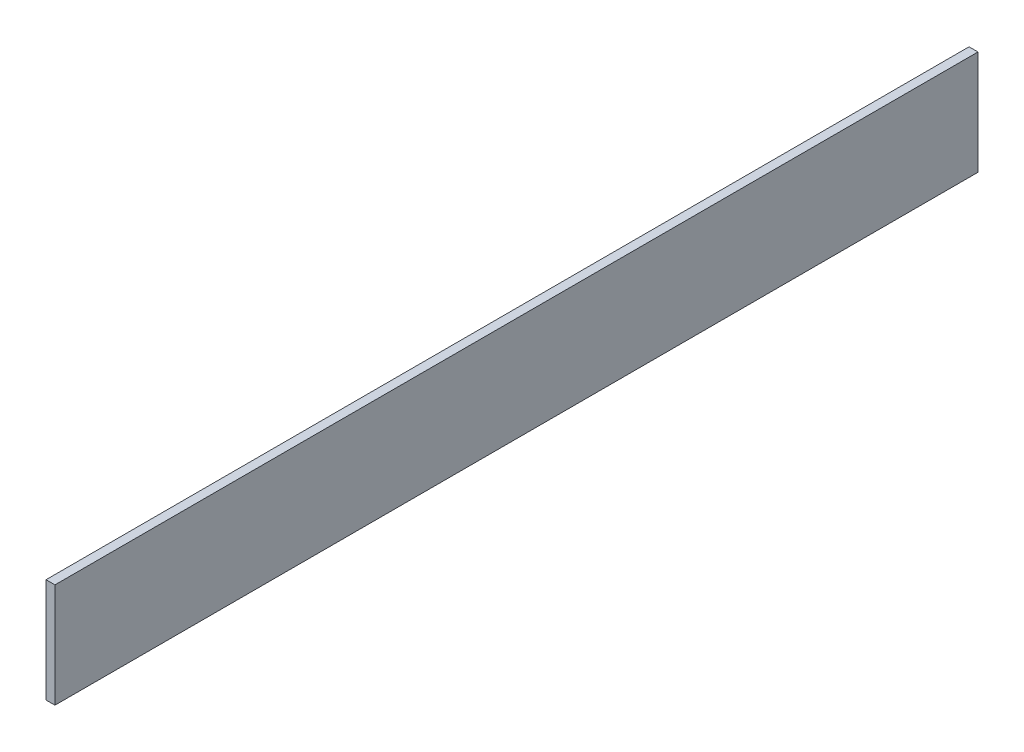
from build123d import *

# Parameters (mm, degrees)
IZIM1_W                     = 310
IZIM1_H                     = 35
Y_KSEKLIK_EKSTR_ZYON1_DEPTH = 3


with BuildPart() as part:
    # Çizim1 → Yükseklik-Ekstrüzyon1 (new body)
    with BuildSketch(Plane(origin=(0, 0, 0), x_dir=(0, 0, -1), z_dir=(1, 0, 0))):
        with Locations((155, 17.5)):
            Rectangle(IZIM1_W, IZIM1_H)
    extrude(amount=Y_KSEKLIK_EKSTR_ZYON1_DEPTH)


solid = part.part
